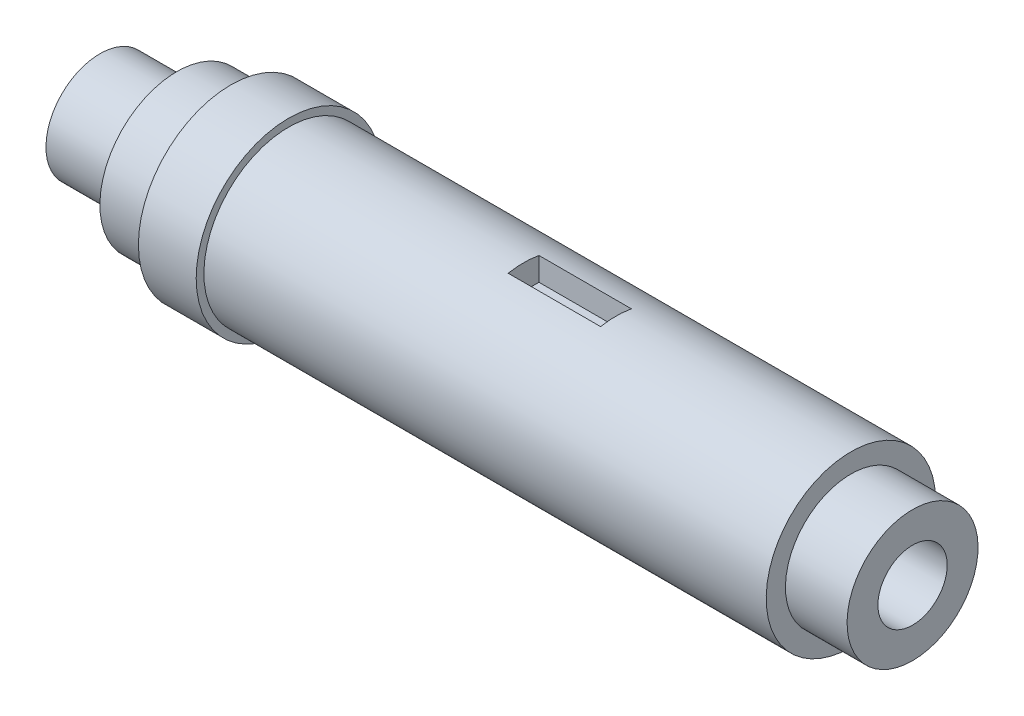
from build123d import *

# Parameters (mm, degrees)
SKETCH7_W          = 12
SKETCH7_H          = 4
CUT_EXTRUDE4_DEPTH = 3.2


with BuildPart() as part:
    # Sketch6 → Revolve2 (revolve)
    with BuildSketch(Plane.XY, mode=Mode.PRIVATE) as revolve2_sk:
        Polygon((-52.75, 4.5), (-52.75, 7), (-42.75, 7), (-42.75, 10), (-35.75, 10), (-35.75, 12), (-28.25, 12), (-28.25, 11), (44.75, 11), (44.75, 8.5), (52.75, 8.5), (52.75, 4.5), align=None)
    revolve(revolve2_sk.sketch.rotate(Axis((-52.75, 0, 0), (1, 0, 0)), 180), axis=Axis((-52.75, 0, 0), (1, 0, 0)))

    # Sketch7 → Cut-Extrude4 (cut)
    with BuildSketch(Plane(origin=(0, 11, 0), x_dir=(1, 0, 0), z_dir=(0, 1, 0))):
        with Locations((8.25, 0)):
            Rectangle(SKETCH7_W, SKETCH7_H)
    extrude(amount=-CUT_EXTRUDE4_DEPTH, mode=Mode.SUBTRACT)


solid = part.part
